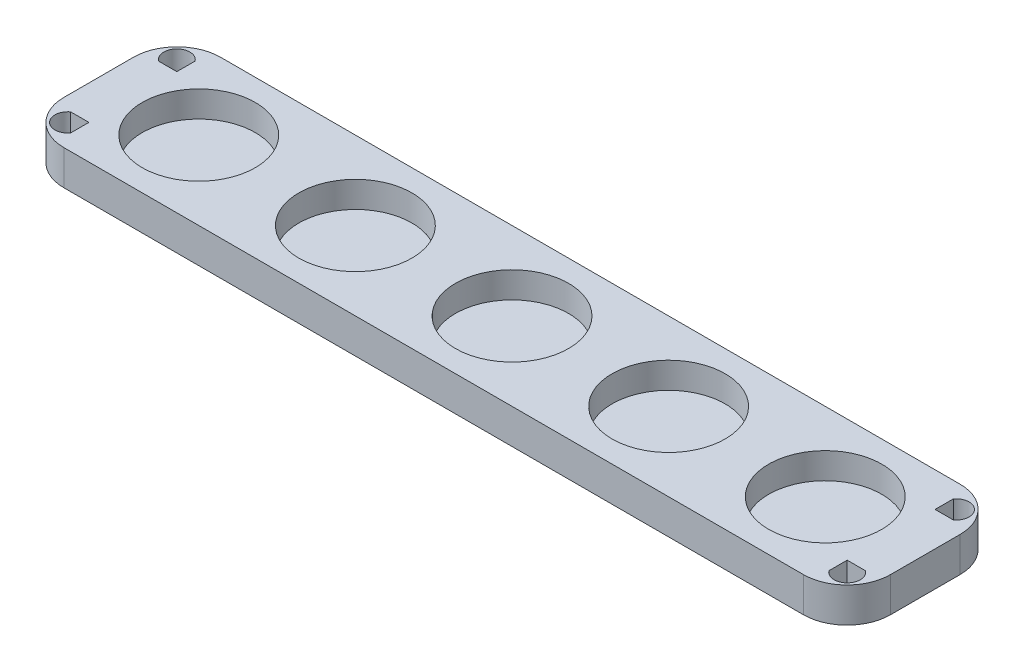
from build123d import *

# Parameters (mm, degrees)
SKETCH5_W           = 190
SKETCH5_H           = 36
BOSS_EXTRUDE1_DEPTH = 8
SKETCH6_R           = 13
SKETCH6_R_2         = 12.99768992
CUT_EXTRUDE1_DEPTH  = 6
FILLET1_R           = 10
CUT_EXTRUDE2_DEPTH  = 8


with BuildPart() as part:
    # Sketch5 → Boss-Extrude1 (new body)
    with BuildSketch(Plane(origin=(0, 0, 0), x_dir=(1, 0, 0), z_dir=(0, 1, 0))):
        with Locations((95, 18)):
            Rectangle(SKETCH5_W, SKETCH5_H)
    extrude(amount=BOSS_EXTRUDE1_DEPTH)

    # Sketch6 → Cut-Extrude1 (cut)
    with BuildSketch(Plane(origin=(0, 8, 0), x_dir=(1, 0, 0), z_dir=(0, 1, 0))):
        with Locations(Location((23, 18, 0), (0, 0, 270))):
            Circle(SKETCH6_R)
        with Locations(Location((59, 18, 0), (0, 0, 270))):
            Circle(SKETCH6_R)
        with Locations(Location((95.004620161, 18, 0), (0, 0, 270))):
            Circle(SKETCH6_R)
        with Locations(Location((131.004620161, 18, 0), (0, 0, 270))):
            Circle(SKETCH6_R)
        with Locations(Location((167.00231008, 18, 0), (0, 0, 270))):
            Circle(SKETCH6_R_2)
    extrude(amount=-CUT_EXTRUDE1_DEPTH, mode=Mode.SUBTRACT)

    # Fillet1
    fillet1_edges = [part.edges().sort_by_distance(p)[0] for p in [
        (0, 4, -36),
        (190, 4, -36),
        (190, 4, 0),
        (0, 4, 0),
    ]]
    fillet(fillet1_edges, radius=FILLET1_R)

    # Sketch9 → Cut-Extrude2 (cut)
    with BuildSketch(Plane(origin=(0, 8, 0), x_dir=(1, 0, 0), z_dir=(0, 1, 0))):
        with BuildLine():
            Line((3.652564445, 7.899803831), (7.852564445, 7.899803831))
            Line((7.852564445, 7.899803831), (7.852564445, 3.699803831))
            ThreePointArc((7.852564445, 3.699803831), (3.324368465, 3.371607851), (3.652564445, 7.899803831))
        make_face()
        with BuildLine():
            Line((7.852564445, 28.100196169), (7.852564445, 32.300196169))
            ThreePointArc((7.852564445, 32.300196169), (3.324368465, 32.628392149), (3.652564445, 28.100196169))
            Line((3.652564445, 28.100196169), (7.852564445, 28.100196169))
        make_face()
        with BuildLine():
            Line((182.147435555, 7.899803831), (182.147435555, 3.699803831))
            ThreePointArc((182.147435555, 3.699803831), (186.675631535, 3.371607851), (186.347435555, 7.899803831))
            Line((186.347435555, 7.899803831), (182.147435555, 7.899803831))
        make_face()
        with BuildLine():
            Line((182.147435555, 28.100196169), (182.147435555, 32.300196169))
            ThreePointArc((182.147435555, 32.300196169), (186.675631535, 32.628392149), (186.347435555, 28.100196169))
            Line((186.347435555, 28.100196169), (182.147435555, 28.100196169))
        make_face()
    extrude(amount=-CUT_EXTRUDE2_DEPTH, mode=Mode.SUBTRACT)


solid = part.part
